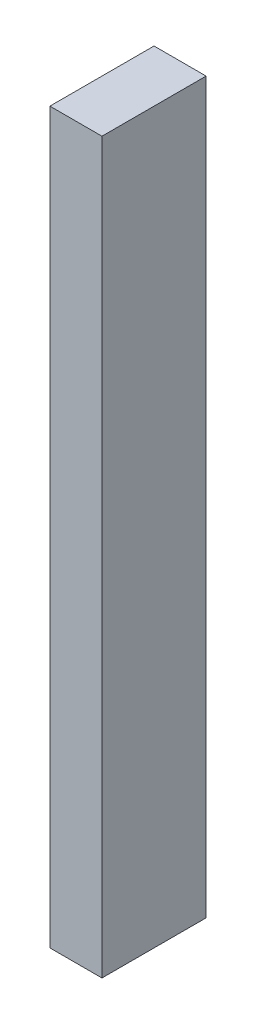
from build123d import *

# Parameters (mm, degrees)
SKETCH1_W           = 50.8
SKETCH1_H           = 101.6
BOSS_EXTRUDE1_DEPTH = 711.2


with BuildPart() as part:
    # Sketch1 → Boss-Extrude1 (new body)
    with BuildSketch(Plane(origin=(0, 0, 0), x_dir=(1, 0, 0), z_dir=(0, 1, 0))):
        with Locations((25.4, 50.8)):
            Rectangle(SKETCH1_W, SKETCH1_H)
    extrude(amount=BOSS_EXTRUDE1_DEPTH)


solid = part.part
